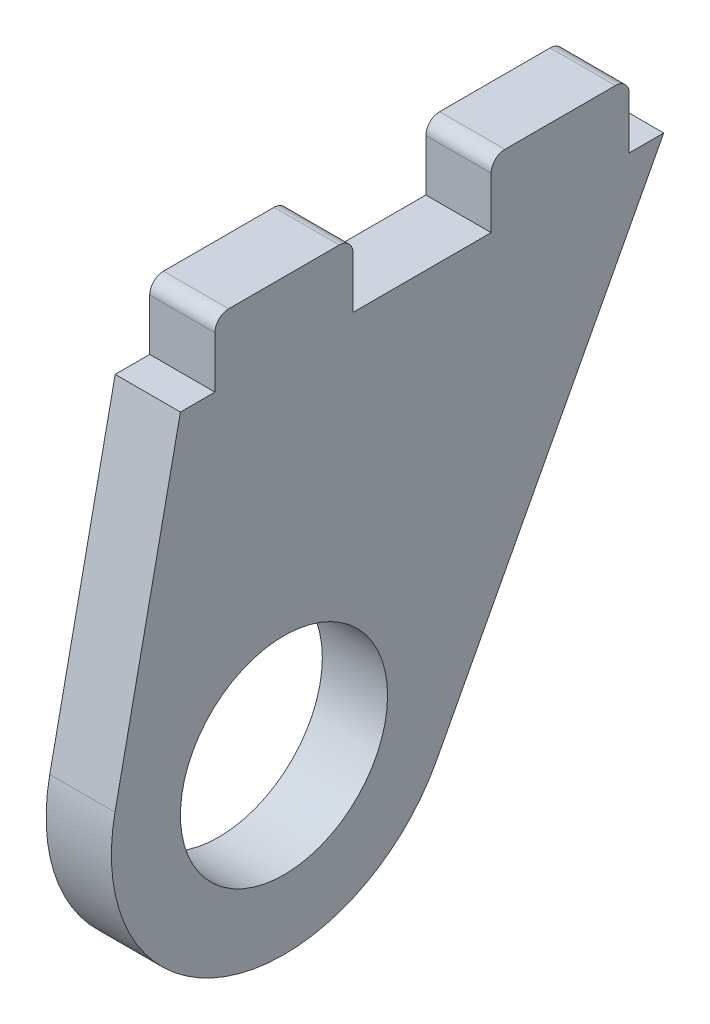
from build123d import *

# Parameters (mm, degrees)
SKETCH1_R              = 9.525
BOSS_EXTRUDE1_DEPTH    = 3
SKETCH3_W              = 6
SKETCH3_H              = 12.7
BOSS_EXTRUDE2_DEPTH    = 6
FILLET1_R              = 1.27
LPATTERN1_COUNT        = 2
LPATTERN1_PITCH        = 25.4
FILLET1_OF_LPATTERN1_R = 1.27


with BuildPart() as part:
    # Sketch1 → Boss-Extrude1 (new, symmetric)
    with BuildSketch(Plane(origin=(0, 0, 0), x_dir=(0, 0, -1), z_dir=(1, 0, 0))):
        with BuildLine():
            Line((-15.540953853, 3.23950279), (-9.525, 32.1))
            Line((-9.525, 32.1), (34.925, 32.1))
            Line((34.925, 32.1), (14.034766421, -7.41895926))
            ThreePointArc((14.034766421, -7.41895926), (-5.382179248, -14.934783947), (-15.540953853, 3.23950279))
        make_face()
        Circle(SKETCH1_R, mode=Mode.SUBTRACT)
    extrude(amount=BOSS_EXTRUDE1_DEPTH, both=True)

    # Sketch3 → Boss-Extrude2 (add)
    with BuildSketch(Plane(origin=(0, 32.1, 0), x_dir=(1, 0, 0), z_dir=(0, 1, 0))):
        Rectangle(SKETCH3_W, SKETCH3_H)
    boss_extrude2 = extrude(amount=BOSS_EXTRUDE2_DEPTH)

    # Fillet1
    fillet1_edges = [part.edges().sort_by_distance(p)[0] for p in [
        (0, 38.1, -6.35),
        (0, 38.1, 6.35),
    ]]
    fillet(fillet1_edges, radius=FILLET1_R)

    # LPattern1: Boss-Extrude2 ×2
    with Locations(*[(0, 0, -i * LPATTERN1_PITCH) for i in range(1, LPATTERN1_COUNT)]):
        add(boss_extrude2)

    # Fillet1 of LPattern1
    fillet1_of_lpattern1_edges = [part.edges().sort_by_distance(p)[0] for p in [
        (0, 38.1, -31.75),
        (0, 38.1, -19.05),
    ]]
    fillet(fillet1_of_lpattern1_edges, radius=FILLET1_OF_LPATTERN1_R)


solid = part.part
